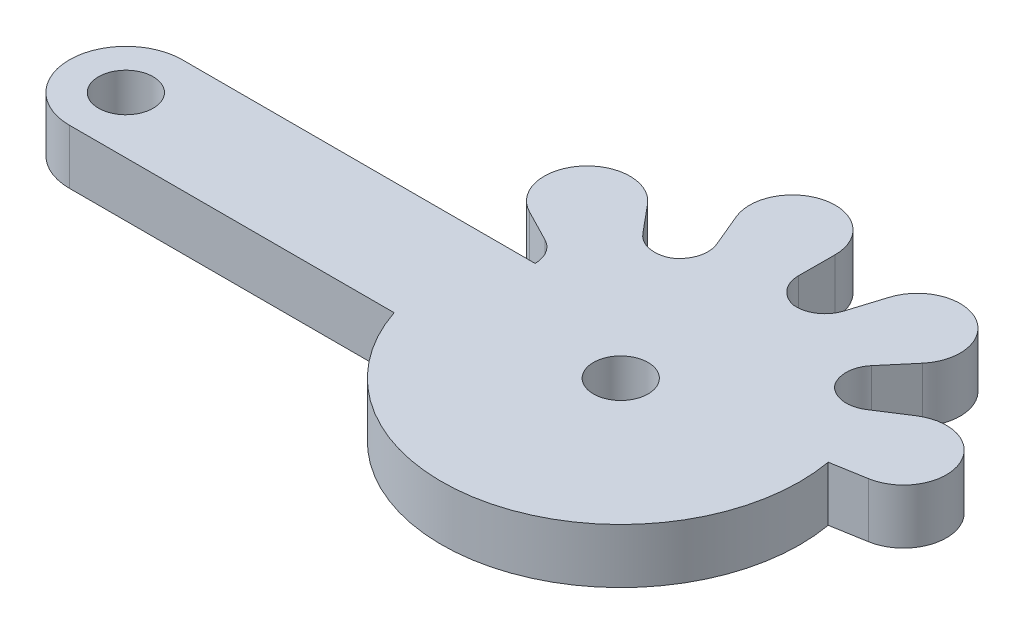
from build123d import *

# Parameters (mm, degrees)
CROQUIS1_R              = 1.5
SALIENTE_EXTRUIR1_DEPTH = 3


with BuildPart() as part:
    # Croquis1 → Saliente-Extruir1 (new body)
    with BuildSketch(Plane(origin=(0, 0, 0), x_dir=(1, 0, 0), z_dir=(0, 1, 0))):
        with BuildLine():
            Line((-27.161614769, -3.105), (-9.331998714, -3.105))
            ThreePointArc((-9.331998714, -3.105), (2.40938914, -9.535306444), (9.686839463, 1.700695802))
            Line((9.686839463, 1.700695802), (11.574510255, 2.02597122))
            ThreePointArc((11.574510255, 2.02597122), (13.368530359, 5.198598559), (9.902464329, 6.325744796))
            Line((9.902464329, 6.325744796), (8.227399936, 5.249463408))
            ThreePointArc((8.227399936, 5.249463408), (7.196926129, 5.010869422), (6.248965214, 5.480095872))
            ThreePointArc((6.248965214, 5.480095872), (5.907504818, 6.481199341), (6.278579258, 7.471707855))
            Line((6.278579258, 7.471707855), (7.564320065, 8.991935775))
            ThreePointArc((7.564320065, 8.991935775), (6.899293653, 12.575483213), (3.519617395, 11.210983026))
            Line((3.519617395, 11.210983026), (2.928263966, 9.309793011))
            ThreePointArc((2.928263966, 9.309793011), (2.29224049, 8.464643619), (1.264447351, 8.214754404))
            ThreePointArc((1.264447351, 8.214754404), (0.359376606, 8.762157641), (0.006949519, 9.759453236))
            Line((0.006949519, 9.759453236), (0.014700448, 11.750473647))
            ThreePointArc((0.014700448, 11.750473647), (-2.798199231, 14.068159511), (-4.510097634, 10.850477702))
            Line((-4.510097634, 10.850477702), (-3.741039257, 9.013966998))
            ThreePointArc((-3.741039257, 9.013966998), (-3.685009949, 7.957716993), (-4.31171948, 7.105638053))
            ThreePointArc((-4.31171948, 7.105638053), (-5.356907913, 6.943205), (-6.267931977, 7.480641985))
            Line((-6.267931977, 7.480641985), (-7.541797671, 9.010834307))
            ThreePointArc((-7.541797671, 9.010834307), (-11.186383596, 8.978187623), (-10.429487856, 5.412913271))
            Line((-10.429487856, 5.412913271), (-8.659868635, 4.500405648))
            ThreePointArc((-8.659868635, 4.500405648), (-8.038781185, 3.922072963), (-7.809412295, 3.105))
            Line((-7.809412295, 3.105), (-27.161614769, 3.105))
            ThreePointArc((-27.161614769, 3.105), (-30.266614769, 0), (-27.161614769, -3.105))
        make_face()
        with Locations(Location((0, 0, 0), (0, 0, 270))):
            Circle(CROQUIS1_R, mode=Mode.SUBTRACT)
        with Locations(Location((-27.161614769, 0, 0), (0, 0, 270))):
            Circle(CROQUIS1_R, mode=Mode.SUBTRACT)
    extrude(amount=SALIENTE_EXTRUIR1_DEPTH)


solid = part.part
